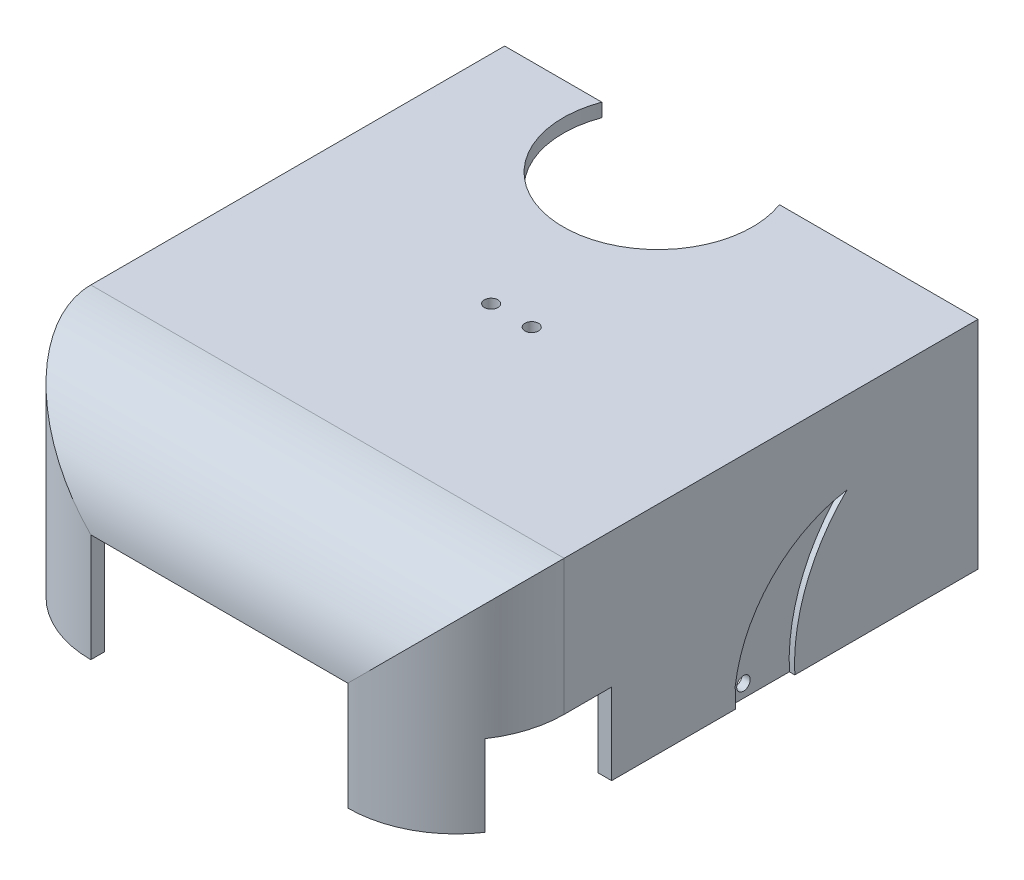
from build123d import *

# Parameters (mm, degrees)
SKETCH_1_W           = 175
SKETCH_1_H           = 160
EXTRUDE_1_DEPTH      = 193
FILLET_8_R           = 40
SHELL_2_T            = -5
SKETCH_9_W           = 95
SKETCH_9_H           = 80
CUT_EXTRUDE_3_DEPTH  = 10
SKETCH_10_R          = 35
CUT_EXTRUDE_4_DEPTH  = 160
SKETCH_12_W          = 40
SKETCH_12_H          = 60
CUT_EXTRUDE_5_DEPTH  = 20
CUT_EXTRUDE_6_DEPTH  = 80
SKETCH_15_R          = 2.5
CUT_EXTRUDE_7_DEPTH  = 5
SKETCH_17_R          = 2.5
CUT_EXTRUDE_9_DEPTH  = 5
CUT_EXTRUDE_10_DEPTH = 2
SKETCH_23_R          = 2.5
CUT_EXTRUDE_13_DEPTH = 5


with BuildPart() as part:
    # 草圖1 → 填料-伸長1 (new body)
    with BuildSketch(Plane.XY):
        Rectangle(SKETCH_1_W, SKETCH_1_H)
    extrude(amount=EXTRUDE_1_DEPTH)

    # 圓角8
    fillet_8_edges = [part.edges().sort_by_distance(p)[0] for p in [
        (-87.5, 0, 193),
        (0, -80, 193),
        (87.5, 0, 193),
        (0, 80, 193),
    ]]
    fillet(fillet_8_edges, radius=FILLET_8_R)

    # 薄殼2
    shell_2_openings = [part.faces().sort_by_distance(p)[0] for p in [
        (0, 0, 0),
    ]]
    offset(amount=SHELL_2_T, openings=shell_2_openings)

    # 草圖9 → 除料-伸長3 (cut)
    with BuildSketch(Plane.XY.offset(193)):
        Rectangle(SKETCH_9_W, SKETCH_9_H)
    extrude(amount=-CUT_EXTRUDE_3_DEPTH, mode=Mode.SUBTRACT)

    # 草圖10 → 除料-伸長4 (cut)
    with BuildSketch(Plane(origin=(0, 80, 0), x_dir=(1, 0, 0), z_dir=(0, 1, 0))):
        with Locations((-18.75, -12.103072957)):
            Circle(SKETCH_10_R)
    extrude(amount=-CUT_EXTRUDE_4_DEPTH, mode=Mode.SUBTRACT)

    # 草圖12 → 除料-伸長5 (cut)
    with BuildSketch(Plane(origin=(90, 0, 0), x_dir=(0, 0, -1), z_dir=(1, 0, 0))):
        with Locations((-155.457670656, 0)):
            Rectangle(SKETCH_12_W, SKETCH_12_H)
    extrude(amount=-CUT_EXTRUDE_5_DEPTH, mode=Mode.SUBTRACT)

    # 草圖4 → 除料-伸長6 (cut)
    with BuildSketch(Plane(origin=(0, 0, 0), x_dir=(1, 0, 0), z_dir=(0, 1, 0))):
        Polygon((0, -200), (-165, -200), (-165, 0), (110, 0), (110, -200), align=None)
    extrude(amount=-CUT_EXTRUDE_6_DEPTH, mode=Mode.SUBTRACT)

    # 草圖15 → 除料-伸長7 (cut)
    with BuildSketch(Plane(origin=(0, 80, 0), x_dir=(1, 0, 0), z_dir=(0, 1, 0))):
        with Locations(Location((7.5, -85, 0), (0, 0, 270))):
            Circle(SKETCH_15_R)
        with Locations(Location((-7.5, -85, 0), (0, 0, 270))):
            Circle(SKETCH_15_R)
    extrude(amount=-CUT_EXTRUDE_7_DEPTH, mode=Mode.SUBTRACT)

    # 草圖17 → 除料-伸長9 (cut)
    with BuildSketch(Plane.ZY.offset(87.5)):
        with Locations((130, 40)):
            Circle(SKETCH_17_R)
        with Locations((142.5, 40)):
            Circle(SKETCH_17_R)
        with Locations((70, 25)):
            Circle(SKETCH_17_R)
        with Locations((95, 25)):
            Circle(SKETCH_17_R)
        Polygon((65, 0), (65, -10), (85, -10), (85, 20), (65, 20), align=None)
    extrude(amount=-CUT_EXTRUDE_9_DEPTH, mode=Mode.SUBTRACT)

    # 草圖18 → 除料-伸長10 (cut)
    with BuildSketch(Plane(origin=(87.5, 0, 0), x_dir=(0, 0, -1), z_dir=(1, 0, 0))):
        with BuildLine():
            Line((-67.728835328, 0), (-89.728835328, 0))
            Line((-89.728835328, 0), (-89.62835003, 2.295574964))
            Line((-89.62835003, 2.295574964), (-89.76926499, 7.293588867))
            ThreePointArc((-89.76926499, 7.293588867), (-76.170437541, 35.347471494), (-48.437401965, 49.589212124))
            ThreePointArc((-48.437401965, 49.589212124), (-63.441387718, 26.87910562), (-67.728835328, 0))
        make_face()
    extrude(amount=-CUT_EXTRUDE_10_DEPTH, mode=Mode.SUBTRACT)

    # 草圖23 → 除料-伸長13 (cut)
    with BuildSketch(Plane(origin=(85.5, 0, 0), x_dir=(0, 0, -1), z_dir=(1, 0, 0))):
        with Locations((-84.69880751, 4.794581915)):
            Circle(SKETCH_23_R)
    extrude(amount=-CUT_EXTRUDE_13_DEPTH, mode=Mode.SUBTRACT)


solid = part.part
